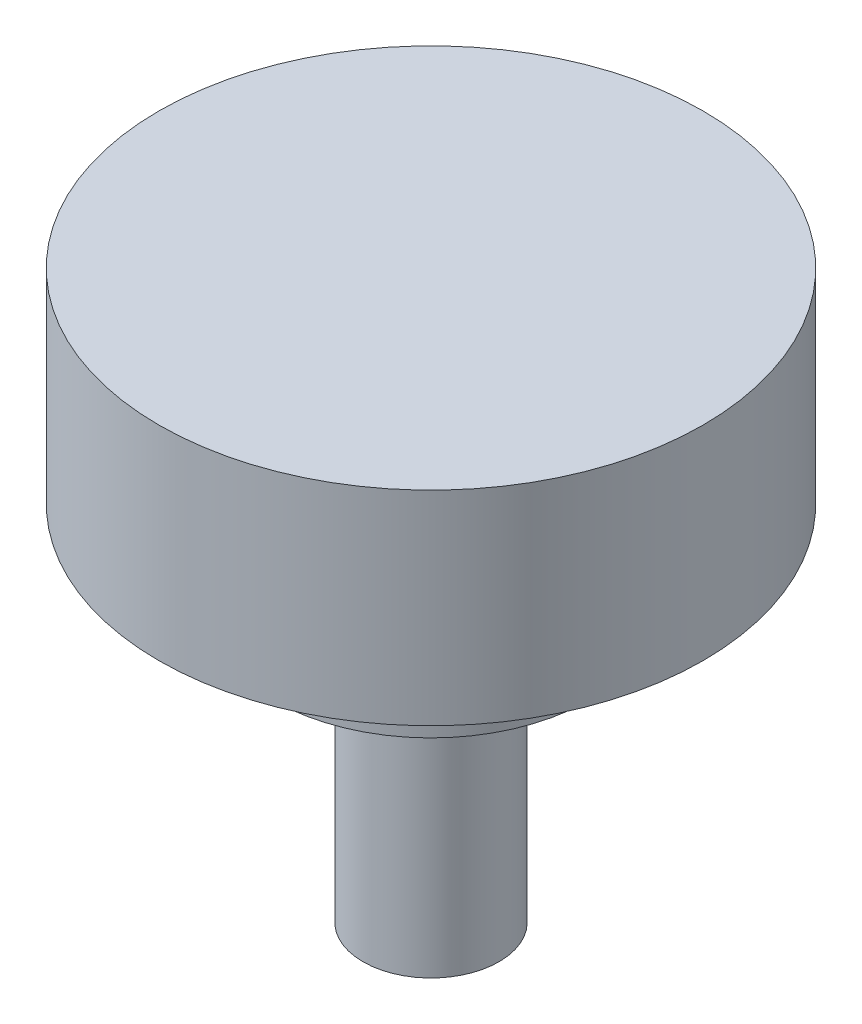
from build123d import *

# Parameters (mm, degrees)
ESQUISSE1_R        = 3
BOSS_EXTRU_1_DEPTH = 12
ESQUISSE2_R        = 7
BOSS_EXTRU_2_DEPTH = 4
ESQUISSE3_R        = 12
BOSS_EXTRU_3_DEPTH = 9


with BuildPart() as part:
    # Esquisse1 → Boss.-Extru.1 (new body)
    with BuildSketch(Plane(origin=(0, 0, 0), x_dir=(1, 0, 0), z_dir=(0, 1, 0))):
        with Locations(Location((0, 0, 0), (0, 0, 270))):
            Circle(ESQUISSE1_R)
    extrude(amount=BOSS_EXTRU_1_DEPTH)

    # Esquisse2 → Boss.-Extru.2 (add)
    with BuildSketch(Plane(origin=(0, 12, 0), x_dir=(1, 0, 0), z_dir=(0, 1, 0))):
        with Locations(Location((0, 0, 0), (0, 0, 270))):
            Circle(ESQUISSE2_R)
    extrude(amount=BOSS_EXTRU_2_DEPTH)

    # Esquisse3 → Boss.-Extru.3 (add)
    with BuildSketch(Plane(origin=(0, 16, 0), x_dir=(1, 0, 0), z_dir=(0, 1, 0))):
        with Locations(Location((0, 0, 0), (0, 0, 270))):
            Circle(ESQUISSE3_R)
    extrude(amount=BOSS_EXTRU_3_DEPTH)


solid = part.part
